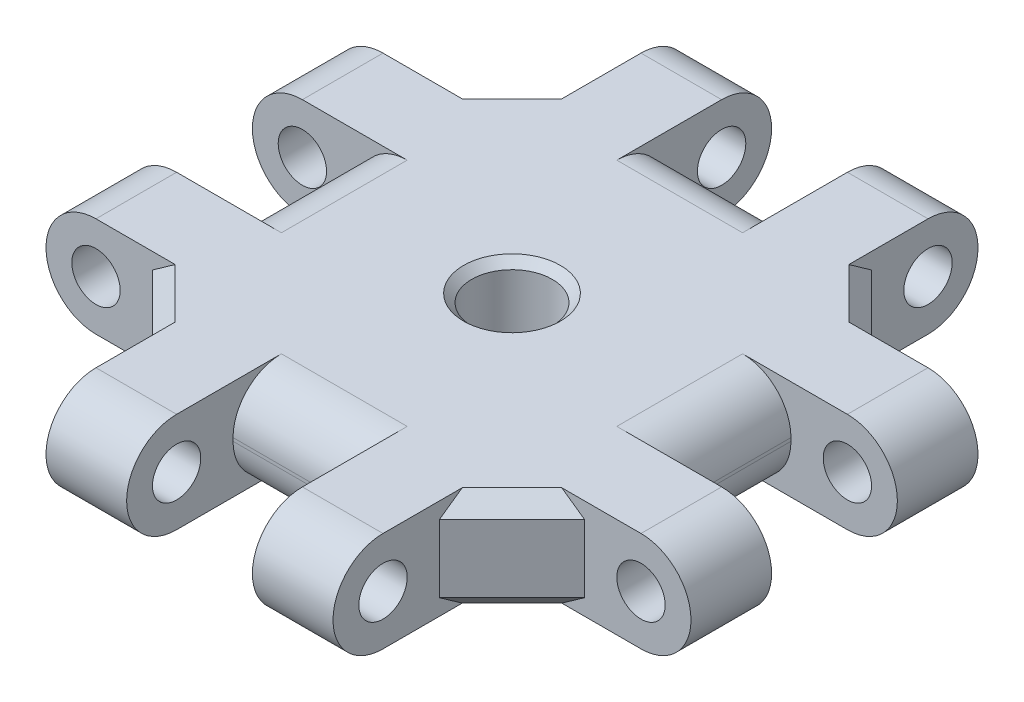
from build123d import *

# Parameters (mm, degrees)
SKETCH1_R           = 2.5
BOSS_EXTRUDE1_DEPTH = 3.1
SKETCH2_R           = 1.5
CUT_EXTRUDE1_DEPTH  = 36.836573497
CIRPATTERN1_COUNT   = 4
FILLET1_R           = 3
CHAMFER1_SIZE       = 1
CHAMFER3_SIZE       = 0.5


with BuildPart() as part:
    # Sketch1 → Boss-Extrude1 (new, symmetric)
    with BuildSketch(Plane(origin=(0, 0, 0), x_dir=(1, 0, 0), z_dir=(0, 1, 0))):
        Polygon((-8.9, -13.4), (-8.9, -20.4), (-3.9, -20.4), (-3.9, -13.4), (3.9, -13.4), (3.9, -20.4), (8.9, -20.4), (8.9, -13.4), (13.4, -8.9), (20.4, -8.9), (20.4, -3.9), (13.4, -3.9), (13.4, 3.9), (20.4, 3.9), (20.4, 8.9), (13.4, 8.9), (8.9, 13.4), (8.9, 20.4), (3.9, 20.4), (3.9, 13.4), (-3.9, 13.4), (-3.9, 20.4), (-8.9, 20.4), (-8.9, 13.4), (-13.4, 8.9), (-20.4, 8.9), (-20.4, 3.9), (-13.4, 3.9), (-13.4, -3.9), (-20.4, -3.9), (-20.4, -8.9), (-13.4, -8.9), align=None)
        with Locations(Location((0, 0, 0), (0, 0, 90))):
            Circle(SKETCH1_R, mode=Mode.SUBTRACT)
    extrude(amount=BOSS_EXTRUDE1_DEPTH, both=True)

    # Sketch2 → Cut-Extrude1 (cut, symmetric)
    with BuildSketch(Plane.ZY.offset(8.9)):
        with Locations((16.9, 0)):
            Circle(SKETCH2_R)
        with BuildLine():
            Line((16.9, 3.1), (20.4, 3.1))
            Line((20.4, 3.1), (20.4, -3.1))
            Line((20.4, -3.1), (16.9, -3.1))
            ThreePointArc((16.9, -3.1), (20, 0), (16.9, 3.1))
        make_face()
    cut_extrude1 = extrude(amount=CUT_EXTRUDE1_DEPTH, both=True, mode=Mode.SUBTRACT)

    # CirPattern1: Cut-Extrude1 ×4 about axis
    cirpattern1_axis = Axis((0, 3.1, 0), (0, 1, 0))
    for i in range(1, CIRPATTERN1_COUNT):
        add(cut_extrude1.rotate(cirpattern1_axis, i * 360 / CIRPATTERN1_COUNT), mode=Mode.SUBTRACT)

    # Fillet1
    fillet1_edges = [part.edges().sort_by_distance(p)[0] for p in [
        (-13.4, 3.1, 0),
        (0, 3.1, 13.4),
        (-13.4, -3.1, 0),
        (0, -3.1, -13.4),
        (13.4, -3.1, 0),
        (0, -3.1, 13.4),
        (13.4, 3.1, 0),
        (0, 3.1, -13.4),
    ]]
    fillet(fillet1_edges, radius=FILLET1_R)

    # Chamfer1
    chamfer1_edges = [part.edges().sort_by_distance(p)[0] for p in [
        (-11.15, 3.1, -11.15),
        (-11.15, -3.1, -11.15),
        (11.15, -3.1, -11.15),
        (11.15, 3.1, 11.15),
        (11.15, -3.1, 11.15),
        (-11.15, -3.1, 11.15),
        (-11.15, 3.1, 11.15),
        (11.15, 3.1, -11.15),
    ]]
    chamfer(chamfer1_edges, length=CHAMFER1_SIZE)

    # Chamfer3
    chamfer3_edges = [part.edges().sort_by_distance(p)[0] for p in [
        (0, -3.1, 2.5),
        (0, 3.1, 2.5),
    ]]
    chamfer(chamfer3_edges, length=CHAMFER3_SIZE)


solid = part.part
